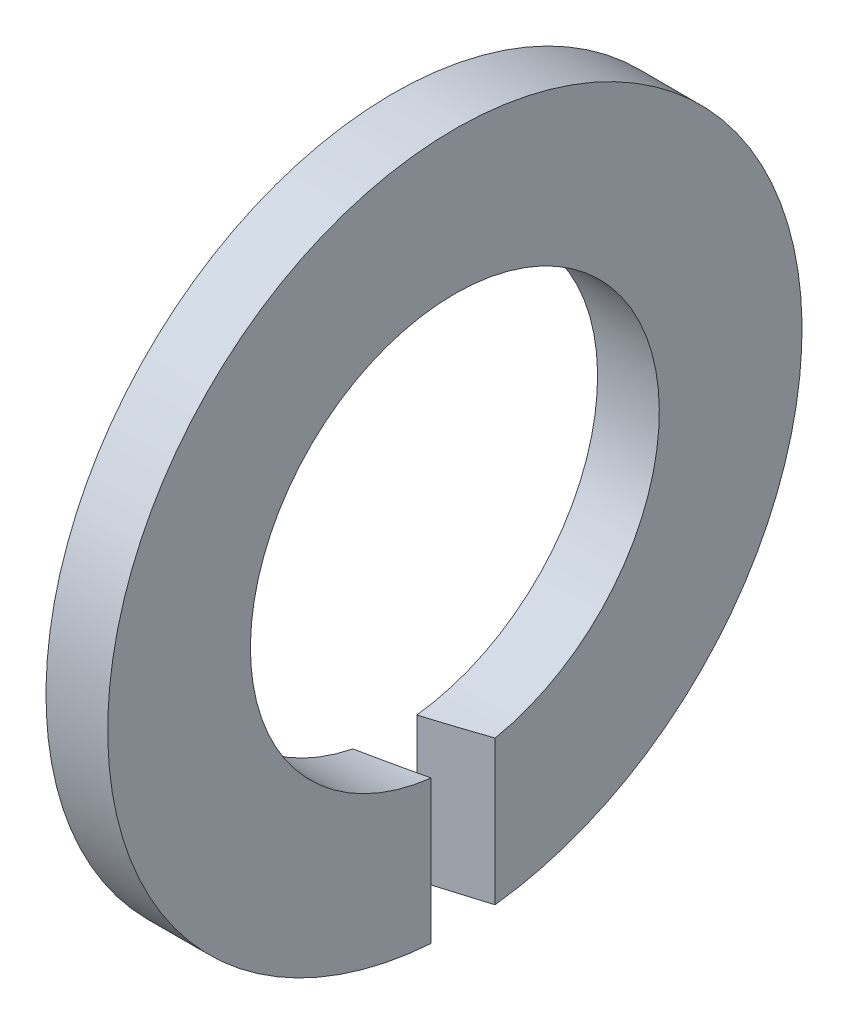
from build123d import *

# Parameters (mm, degrees)
SKETCH1_W               = 0.8
SKETCH1_H               = 1.85
ENL_V_MAT_EXTRU_1_DEPTH = 10


with BuildPart() as part:
    # Sketch1 → Base-Revolve (revolve)
    with BuildSketch(Plane.XY, mode=Mode.PRIVATE) as base_revolve_sk:
        with Locations((-0.4, 3.575)):
            Rectangle(SKETCH1_W, SKETCH1_H)
    revolve(base_revolve_sk.sketch.rotate(Axis((-34.925, 0, 0), (1, 0, 0)), 90), axis=Axis((-34.925, 0, 0), (1, 0, 0)))

    # Esquisse1 → Enlèv. mat.-Extru.1 (cut)
    with BuildSketch(Plane(origin=(0, 0, 0), x_dir=(0, 0, -1), z_dir=(0, 1, 0))):
        Polygon((-0.521290149, 0.8), (-0.251450512, -0.207055236), (0.521290149, 0), (0.251450512, 1.007055236), align=None)
    extrude(amount=-ENL_V_MAT_EXTRU_1_DEPTH, mode=Mode.SUBTRACT)


solid = part.part
